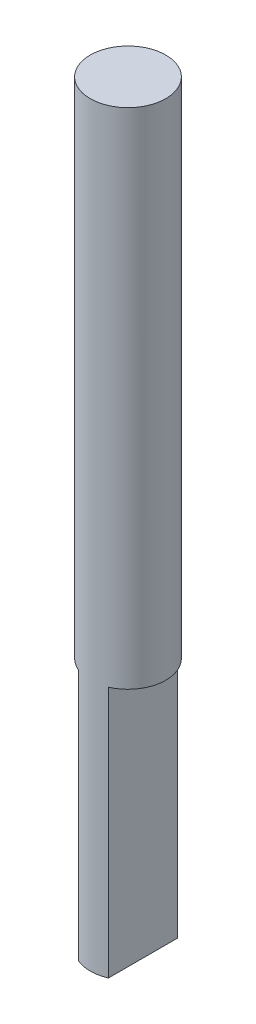
from build123d import *

# Parameters (mm, degrees)
SKETCH1_R           = 0.75
BOSS_EXTRUDE1_DEPTH = 15
CUT_EXTRUDE1_DEPTH  = 5


with BuildPart() as part:
    # Sketch1 → Boss-Extrude1 (new body)
    with BuildSketch(Plane(origin=(0, 0, 0), x_dir=(1, 0, 0), z_dir=(0, 1, 0))):
        with Locations(Location((0, 0, 0), (0, 0, 270))):
            Circle(SKETCH1_R)
    extrude(amount=BOSS_EXTRUDE1_DEPTH)

    # Sketch2 → Cut-Extrude1 (cut)
    with BuildSketch(Plane.XZ):
        with BuildLine():
            Line((-0.3, 0.687386354), (-0.3, -0.687386354))
            ThreePointArc((-0.3, -0.687386354), (-0.75, 0), (-0.3, 0.687386354))
        make_face()
        with BuildLine():
            Line((0.3, 0.687386354), (0.3, -0.687386354))
            ThreePointArc((0.3, -0.687386354), (0.75, 0), (0.3, 0.687386354))
        make_face()
    extrude(amount=-CUT_EXTRUDE1_DEPTH, mode=Mode.SUBTRACT)


solid = part.part
